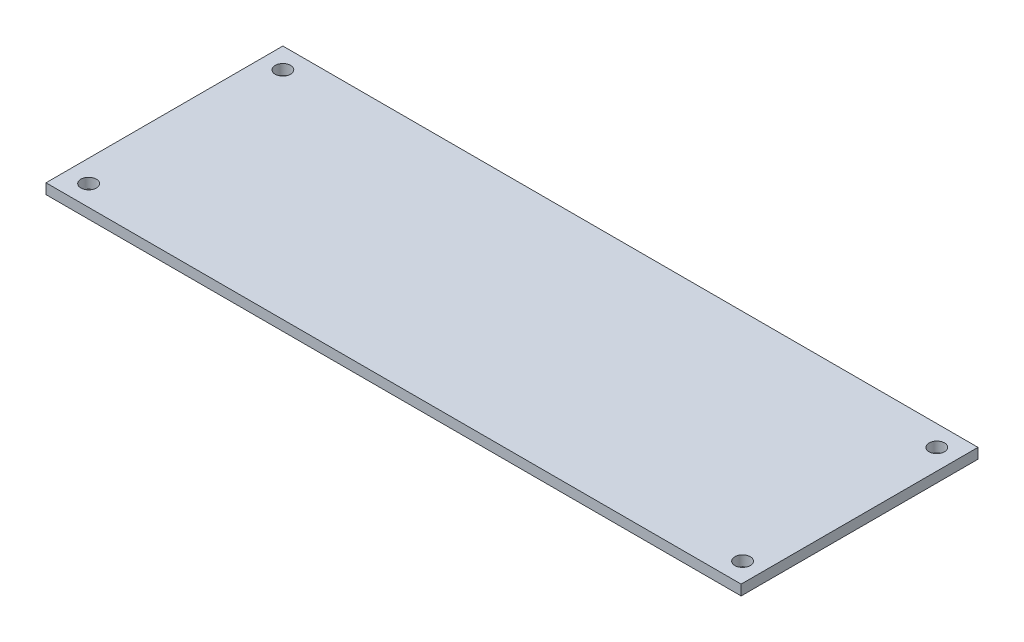
from build123d import *

# Parameters (mm, degrees)
SKETCH1_W           = 135
SKETCH1_H           = 46
SKETCH1_R           = 1.5
BOSS_EXTRUDE1_DEPTH = 2


with BuildPart() as part:
    # Sketch1 → Boss-Extrude1 (new body)
    with BuildSketch(Plane(origin=(0, 0, 0), x_dir=(1, 0, 0), z_dir=(0, 1, 0))):
        Rectangle(SKETCH1_W, SKETCH1_H)
        with Locations(Location((-63.5, 19, 0), (0, 0, 270))):
            Circle(SKETCH1_R, mode=Mode.SUBTRACT)
        with Locations(Location((63.5, 19, 0), (0, 0, 270))):
            Circle(SKETCH1_R, mode=Mode.SUBTRACT)
        with Locations(Location((63.777503424, -19, 0), (0, 0, 270))):
            Circle(SKETCH1_R, mode=Mode.SUBTRACT)
        with Locations(Location((-63.222496576, -18.998986721, 0), (0, 0, 270))):
            Circle(SKETCH1_R, mode=Mode.SUBTRACT)
    extrude(amount=BOSS_EXTRUDE1_DEPTH)


solid = part.part
